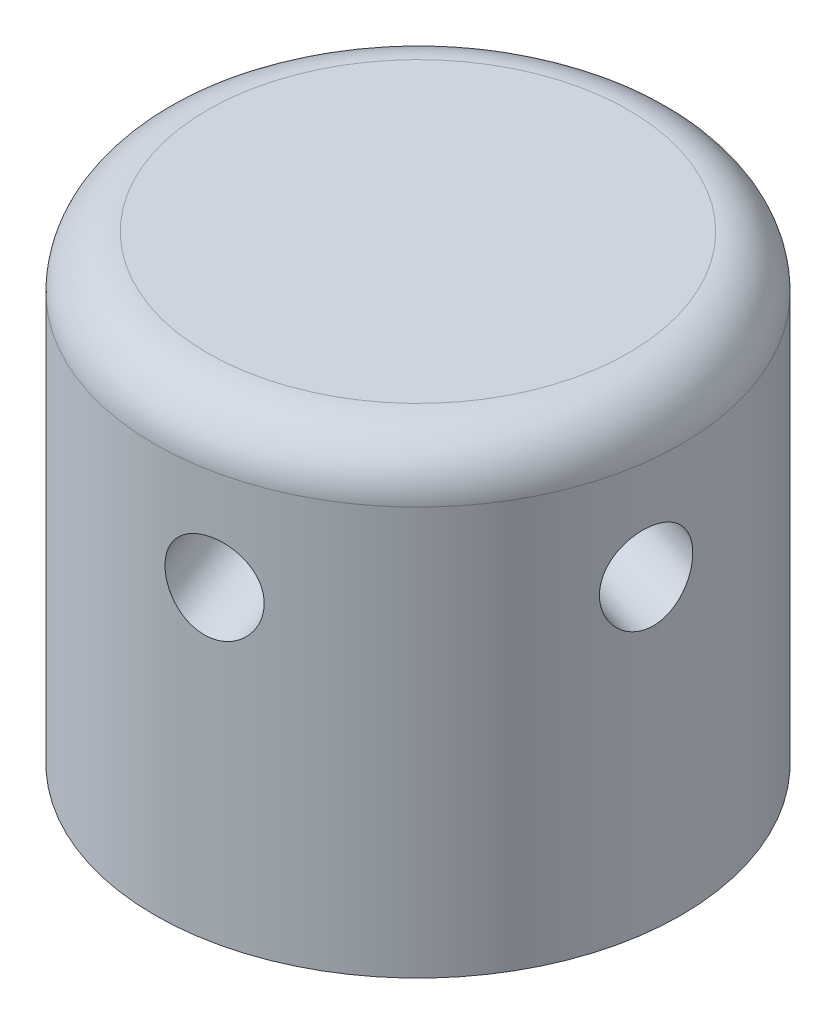
from build123d import *

# Parameters (mm, degrees)
BOSS_EXTRUDE1_DEPTH      = 3
BOSS_EXTRUDE1_DEPTH_BACK = 6
SKETCH1_R                = 10
SKETCH4_R                = 1.6
HOLE_DEPTH               = 19.539009706
HOLECIR_COUNT            = 5
FILLET3_R                = 2
BOSS_EXTRUDE2_START      = 8.5
SKETCH5_R                = 10
BOSS_EXTRUDE2_DEPTH      = 8.5
SKETCH6_R                = 2
CUT_EXTRUDE1_DEPTH       = 11.1


with BuildPart() as part:
    # Sketch1 → Boss-Extrude1 (new, two sides: drawn at the far end of the back side and taken through both)
    with BuildSketch(Plane(origin=(0, 0, 0), x_dir=(1, 0, 0), z_dir=(0, 1, 0)).offset(-BOSS_EXTRUDE1_DEPTH_BACK)):
        Circle(SKETCH1_R)
    extrude(amount=BOSS_EXTRUDE1_DEPTH + BOSS_EXTRUDE1_DEPTH_BACK)

    # Sketch4 → hole (cut, through all)
    with BuildSketch(Plane(origin=(-3.352872105, -1.093066116, 1.887711608), x_dir=(-0.4486862613641547, -0.14627571033740308, -0.8816371449912632), z_dir=(0.8382180262940947, 0.2732665289126682, -0.47192790187872385))):
        Circle(SKETCH4_R)
    hole = extrude(amount=-HOLE_DEPTH, mode=Mode.SUBTRACT)

    # holecir: hole ×5 about axis
    holecir_axis = Axis((0, 5.5, 0), (0, -1, 0))
    for i in range(1, HOLECIR_COUNT):
        add(hole.rotate(holecir_axis, i * 360 / HOLECIR_COUNT), mode=Mode.SUBTRACT)

    # Fillet3
    fillet3_edges = [part.edges().sort_by_distance(p)[0] for p in [
        (-10, 3, 0),
    ]]
    fillet(fillet3_edges, radius=FILLET3_R)

    # Sketch5 → Boss-Extrude2 (add)
    with BuildSketch(Plane.XZ.offset(6).offset(BOSS_EXTRUDE2_START)):
        Circle(SKETCH5_R)
    extrude(amount=-BOSS_EXTRUDE2_DEPTH)

    # Sketch6 → Cut-Extrude1 (cut)
    with BuildSketch(Plane.XZ.offset(14.5)):
        Circle(SKETCH6_R)
    extrude(amount=-CUT_EXTRUDE1_DEPTH, mode=Mode.SUBTRACT)


solid = part.part
